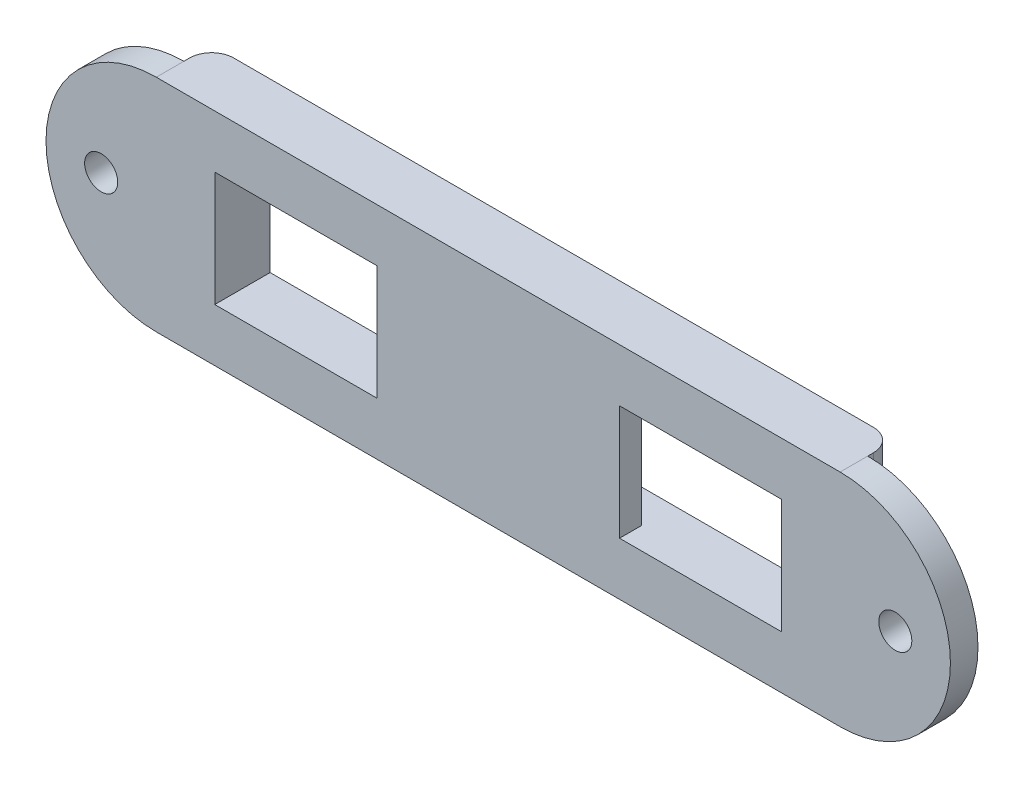
from build123d import *

# Parameters (mm, degrees)
SKETCH1_W            = 62
SKETCH1_H            = 20
SKETCH1_W_2          = 51.4
SKETCH1_H_2          = 10.4
BOSS_EXTRUDE2_DEPTH  = 3.02
SKETCH3_W            = 62
SKETCH3_H            = 20
BOSS_EXTRUDE3_DEPTH  = 2
SKETCH5_W            = 8.5
SKETCH5_H            = 10.4
CUT_EXTRUDE1_DEPTH   = 10
SKETCH19_W           = 34.4
SKETCH19_H           = 2.300107623
SKETCH19_H_2         = 2.300107622
CUT_EXTRUDE7_DEPTH   = 4
SKETCH21_W           = 7
SKETCH21_H           = 7.100107623
SKETCH21_H_2         = 5.799784755
SKETCH21_H_3         = 7.100107622
SKETCH21_W_2         = 4
BOSS_EXTRUDE11_DEPTH = 2
SKETCH22_R           = 1.5
BOSS_EXTRUDE12_DEPTH = 2.5
FILLET1_R            = 2
FILLET2_R            = 2
SKETCH25_W           = 57.10557297
SKETCH25_H           = 5.799784755
SKETCH25_W_2         = 34.4
BOSS_EXTRUDE13_DEPTH = 3.8
SKETCH26_W           = 57.10557297
SKETCH26_H           = 5.799784755
CUT_EXTRUDE8_DEPTH   = 3.8
SKETCH27_W           = 34.4
SKETCH27_H           = 3.8
CUT_EXTRUDE9_DEPTH   = 20
SKETCH28_W           = 6.2
SKETCH28_H           = 5.799784755
CUT_EXTRUDE10_DEPTH  = 20


with BuildPart() as part:
    # Sketch1 → Boss-Extrude2 (new body)
    with BuildSketch(Plane.XY):
        with Locations((22.463748762, 43.895041876)):
            Rectangle(SKETCH1_W, SKETCH1_H)
        with Locations((22.463748762, 43.895041876)):
            Rectangle(SKETCH1_W_2, SKETCH1_H_2, mode=Mode.SUBTRACT)
    extrude(amount=BOSS_EXTRUDE2_DEPTH)

    # Sketch3 → Boss-Extrude3 (add)
    with BuildSketch(Plane.XY.offset(3.02)):
        with Locations((22.463748762, 43.895041876)):
            Rectangle(SKETCH3_W, SKETCH3_H)
    extrude(amount=BOSS_EXTRUDE3_DEPTH)

    # Sketch5 → Cut-Extrude1 (cut)
    with BuildSketch(Plane(origin=(0, 0, 3.02), x_dir=(-1, 0, 0), z_dir=(0, 0, -1))):
        with Locations((-1.013748762, 43.895041876)):
            Rectangle(SKETCH5_W, SKETCH5_H)
        with Locations((-43.913748762, 43.895041876)):
            Rectangle(SKETCH5_W, SKETCH5_H)
    extrude(amount=-CUT_EXTRUDE1_DEPTH, mode=Mode.SUBTRACT)

    # Sketch19 → Cut-Extrude7 (cut)
    with BuildSketch(Plane.XY.offset(5.02)):
        with Locations((22.463748762, 47.944988065)):
            Rectangle(SKETCH19_W, SKETCH19_H)
        with Locations((22.463748762, 39.845095687)):
            Rectangle(SKETCH19_W, SKETCH19_H_2)
    extrude(amount=-CUT_EXTRUDE7_DEPTH, mode=Mode.SUBTRACT)


with BuildPart() as cut_extrude7_piece_1:
    # of the separate pieces the step leaves, piece 1, a body of its own (cut_extrude7_pieces)
    add(part.part.solids().sort_by_distance((-8.536251238, 33.895041876, 0))[0])



with BuildPart() as cut_extrude7_piece_2:
    # of the separate pieces the step leaves, piece 2, a body of its own (cut_extrude7_pieces)
    add(part.part.solids().sort_by_distance((5.263748762, 46.794934253, 5.02))[0])


with BuildPart() as cut_extrude7_piece_1_1:
    add(cut_extrude7_piece_1.part)

    add(cut_extrude7_piece_2.part)  # Boss-Extrude11 merges Cut-Extrude7 piece 2
    # Sketch21 → Boss-Extrude11 (add)
    with BuildSketch(Plane.XY.offset(5.02)):
        with Locations((29.963748762, 50.344988065)):
            Rectangle(SKETCH21_W, SKETCH21_H)
        with Locations((29.963748762, 43.895041875)):
            Rectangle(SKETCH21_W, SKETCH21_H_2)
        with Locations((29.963748762, 37.445095687)):
            Rectangle(SKETCH21_W, SKETCH21_H_3)
        with Locations((14.963748762, 37.445095687)):
            Rectangle(SKETCH21_W, SKETCH21_H_3)
        with Locations((14.963748762, 43.895041875)):
            Rectangle(SKETCH21_W, SKETCH21_H_2)
        with Locations((14.963748762, 50.344988065)):
            Rectangle(SKETCH21_W, SKETCH21_H)
        with Locations((24.463748762, 50.344988065)):
            Rectangle(SKETCH21_W_2, SKETCH21_H)
        with Locations((24.463748762, 43.895041875)):
            Rectangle(SKETCH21_W_2, SKETCH21_H_2)
        with Locations((24.463748762, 37.445095687)):
            Rectangle(SKETCH21_W_2, SKETCH21_H_3)
        with Locations((20.463748762, 37.445095687)):
            Rectangle(SKETCH21_W_2, SKETCH21_H_3)
        with Locations((20.463748762, 43.895041875)):
            Rectangle(SKETCH21_W_2, SKETCH21_H_2)
        with Locations((20.463748762, 50.344988065)):
            Rectangle(SKETCH21_W_2, SKETCH21_H)
    extrude(amount=-BOSS_EXTRUDE11_DEPTH)

    # Sketch22 → Boss-Extrude12 (add)
    # profile 1 of 2: a face of its own
    with BuildSketch(Plane.XY.offset(5.02)):
        with BuildLine():
            ThreePointArc((53.463748762, 33.895041876), (63.463748762, 43.895041876), (53.463748762, 53.895041876))
            Line((53.463748762, 53.895041876), (53.463748762, 33.895041876))
        make_face()
        with Locations((58.463748762, 43.895041876)):
            Circle(SKETCH22_R, mode=Mode.SUBTRACT)
    # profile 2 of 2: a face of its own
    with BuildSketch(Plane.XY.offset(5.02)):
        with BuildLine():
            ThreePointArc((-8.536251238, 33.895041876), (-18.536251238, 43.895041876), (-8.536251238, 53.895041876))
            Line((-8.536251238, 53.895041876), (-8.536251238, 33.895041876))
        make_face()
        with Locations((-13.536251238, 43.895041876)):
            Circle(SKETCH22_R, mode=Mode.SUBTRACT)
    extrude(amount=-BOSS_EXTRUDE12_DEPTH)

    # Fillet1
    fillet1_edges = [cut_extrude7_piece_1_1.edges().sort_by_distance(p)[0] for p in [
        (53.463748762, 43.895041876, 0),
    ]]
    fillet(fillet1_edges, radius=FILLET1_R)

    # Fillet2
    fillet2_edges = [cut_extrude7_piece_1_1.edges().sort_by_distance(p)[0] for p in [
        (-8.536251238, 43.895041876, 0),
    ]]
    fillet(fillet2_edges, radius=FILLET2_R)

    # Sketch25 → Boss-Extrude13 (add)
    with BuildSketch(Plane.XY.offset(5.02)):
        with Locations((20.043435204, 67.888102351)):
            Rectangle(SKETCH25_W, SKETCH25_H)
        with Locations((22.463748762, 43.895041875)):
            Rectangle(SKETCH25_W_2, SKETCH25_H)
    extrude(amount=BOSS_EXTRUDE13_DEPTH)


with BuildPart() as boss_extrude13_piece_1:
    # of the separate pieces the step leaves, piece 1, a body of its own (boss_extrude13_pieces)
    add(cut_extrude7_piece_1_1.part.solids().sort_by_distance((-6.536251238, 33.895041876, 0))[0])

    # Sketch27 → Cut-Extrude9 (cut)
    with BuildSketch(Plane.XZ.offset(-40.995149498)):
        with Locations((22.463748762, 6.92)):
            Rectangle(SKETCH27_W, SKETCH27_H)
    extrude(amount=-CUT_EXTRUDE9_DEPTH, mode=Mode.SUBTRACT)

    # Sketch28 → Cut-Extrude10 (cut)
    with BuildSketch(Plane.XY.offset(5.02)):
        with Locations((36.563748762, 43.895041875)):
            Rectangle(SKETCH28_W, SKETCH28_H)
        with Locations((8.363748762, 43.895041875)):
            Rectangle(SKETCH28_W, SKETCH28_H)
    extrude(amount=-CUT_EXTRUDE10_DEPTH, mode=Mode.SUBTRACT)


with BuildPart() as boss_extrude13_piece_2:
    # of the separate pieces the step leaves, piece 2, a body of its own (boss_extrude13_pieces)
    add(cut_extrude7_piece_1_1.part.solids().sort_by_distance((-8.509351281, 70.787994728, 5.02))[0])

    # Sketch26 → Cut-Extrude8 (cut)
    with BuildSketch(Plane(origin=(0, 0, 5.02), x_dir=(-1, 0, 0), z_dir=(0, 0, -1))):
        with Locations((-20.043435204, 67.888102351)):
            Rectangle(SKETCH26_W, SKETCH26_H)
    extrude(amount=-CUT_EXTRUDE8_DEPTH, mode=Mode.SUBTRACT)


solid = boss_extrude13_piece_1.part
